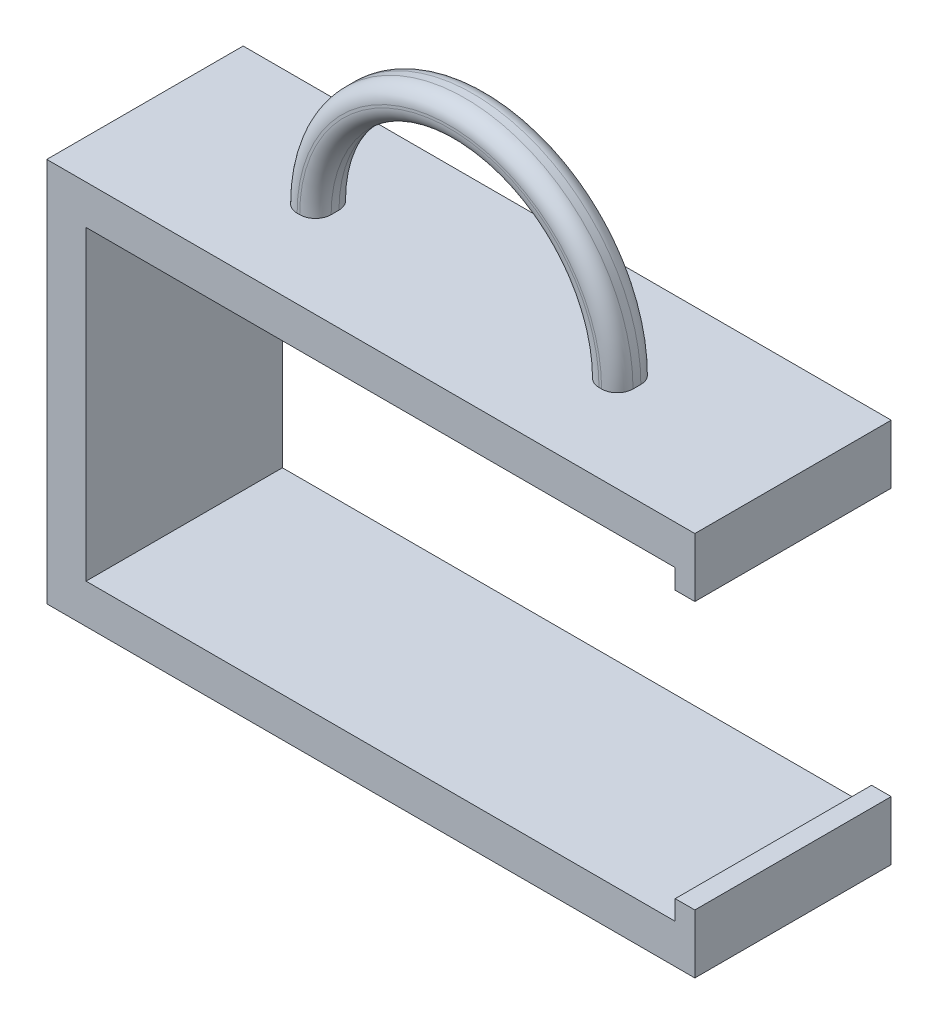
from build123d import *

# Parameters (mm, degrees)
SKETCH1_W               = 82.5
SKETCH1_H               = 25
BOSS_EXTRUDE1_DEPTH     = 5
SKETCH2_W               = 5
SKETCH2_H               = 25
BOSS_EXTRUDE2_DEPTH     = 39
SKETCH3_W               = 82.5
SKETCH3_H               = 25
BOSS_EXTRUDE3_DEPTH     = 5
BOSS_EXTRUDE4_DEPTH     = 2.5
SKETCH5_W               = 2.5
SKETCH5_H               = 39
BOSS_EXTRUDE5_DEPTH     = 25
CUT_EXTRUDE1_DEPTH      = 86.323912034
CUT_EXTRUDE1_DEPTH_BACK = 25
SKETCH6_W               = 5
SKETCH6_H               = 34
FILLET1_R               = 2
FILLET2_R               = 2


with BuildPart() as part:
    # Sketch1 → Boss-Extrude1 (new body)
    with BuildSketch(Plane(origin=(0, 0, 0), x_dir=(1, 0, 0), z_dir=(0, 1, 0))):
        Rectangle(SKETCH1_W, SKETCH1_H)
    extrude(amount=BOSS_EXTRUDE1_DEPTH)

    # Sketch2 → Boss-Extrude2 (add)
    with BuildSketch(Plane(origin=(0, 5, 0), x_dir=(1, 0, 0), z_dir=(0, 1, 0))):
        with Locations((-38.75, 0)):
            Rectangle(SKETCH2_W, SKETCH2_H)
    extrude(amount=BOSS_EXTRUDE2_DEPTH)

    # Sketch3 → Boss-Extrude3 (add)
    with BuildSketch(Plane(origin=(0, 44, 0), x_dir=(1, 0, 0), z_dir=(0, 1, 0))):
        Rectangle(SKETCH3_W, SKETCH3_H)
    extrude(amount=BOSS_EXTRUDE3_DEPTH)

    # Sketch4 → Boss-Extrude4 (add, symmetric)
    with BuildSketch(Plane.XY):
        with BuildLine():
            Line((-17.053024247, 49), (-21.381868864, 49))
            ThreePointArc((-21.381868864, 49), (0, 70.381868864), (21.381868864, 49))
            Line((21.381868864, 49), (17.053024247, 49))
            ThreePointArc((17.053024247, 49), (0, 66.053024247), (-17.053024247, 49))
        make_face()
    extrude(amount=BOSS_EXTRUDE4_DEPTH, both=True)

    # Sketch5 → Boss-Extrude5 (add)
    with BuildSketch(Plane.XY.offset(12.5)):
        with Locations((40, 24.5)):
            Rectangle(SKETCH5_W, SKETCH5_H)
    extrude(amount=-BOSS_EXTRUDE5_DEPTH)

    # Sketch6 → Cut-Extrude1 (cut, two sides: drawn at the far end of the back side and taken through both)
    with BuildSketch(Plane.XY.offset(12.5).offset(-CUT_EXTRUDE1_DEPTH_BACK)):
        with Locations((38.75, 24.5)):
            Rectangle(SKETCH6_W, SKETCH6_H)
    extrude(amount=CUT_EXTRUDE1_DEPTH + CUT_EXTRUDE1_DEPTH_BACK, mode=Mode.SUBTRACT)

    # Fillet1
    fillet1_edges = [part.edges().sort_by_distance(p)[0] for p in [
        (0, 70.381868864, -2.5),
        (0, 70.381868864, 2.5),
    ]]
    fillet(fillet1_edges, radius=FILLET1_R)

    # Fillet2
    fillet2_edges = [part.edges().sort_by_distance(p)[0] for p in [
        (0, 66.053024247, -2.5),
        (0, 66.053024247, 2.5),
    ]]
    fillet(fillet2_edges, radius=FILLET2_R)


solid = part.part
